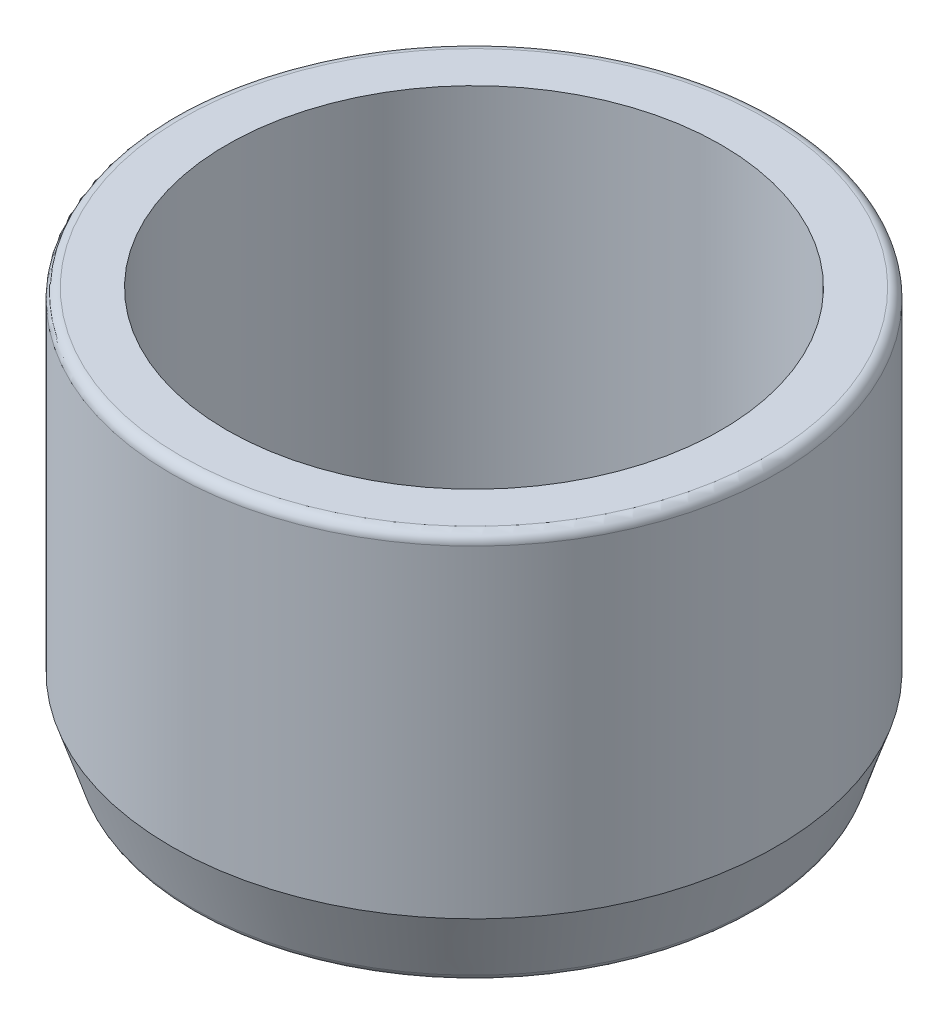
from build123d import *

# Parameters (mm, degrees)
SKETCH1_R           = 30
SKETCH1_R_2         = 24.5
BOSS_EXTRUDE1_DEPTH = 20
CHAMFER2_SIZE       = 2.31
CHAMFER2_SIZE2      = 7
FILLET1_R           = 1


with BuildPart() as part:
    # Sketch1 → Boss-Extrude1 (new, symmetric)
    with BuildSketch(Plane(origin=(0, 0, 0), x_dir=(1, 0, 0), z_dir=(0, 1, 0))):
        with Locations(Location((0, 0, 0), (0, 0, 270))):
            Circle(SKETCH1_R)
        with Locations(Location((0, 0, 0), (0, 0, 270))):
            Circle(SKETCH1_R_2, mode=Mode.SUBTRACT)
    extrude(amount=BOSS_EXTRUDE1_DEPTH, both=True)

    # Chamfer2
    chamfer2_edges = [part.edges().sort_by_distance(p)[0] for p in [
        (0, -20, -30),
    ]]
    chamfer2_side = [part.faces().sort_by_distance(p)[0] for p in [
        (0, -20, -29.151471863),
    ]]
    chamfer(chamfer2_edges, length=CHAMFER2_SIZE, length2=CHAMFER2_SIZE2, reference=chamfer2_side[0])

    # Fillet1
    fillet1_edges = [part.edges().sort_by_distance(p)[0] for p in [
        (0, -20, -27.69),
        (0, 20, -30),
    ]]
    fillet(fillet1_edges, radius=FILLET1_R)


solid = part.part
